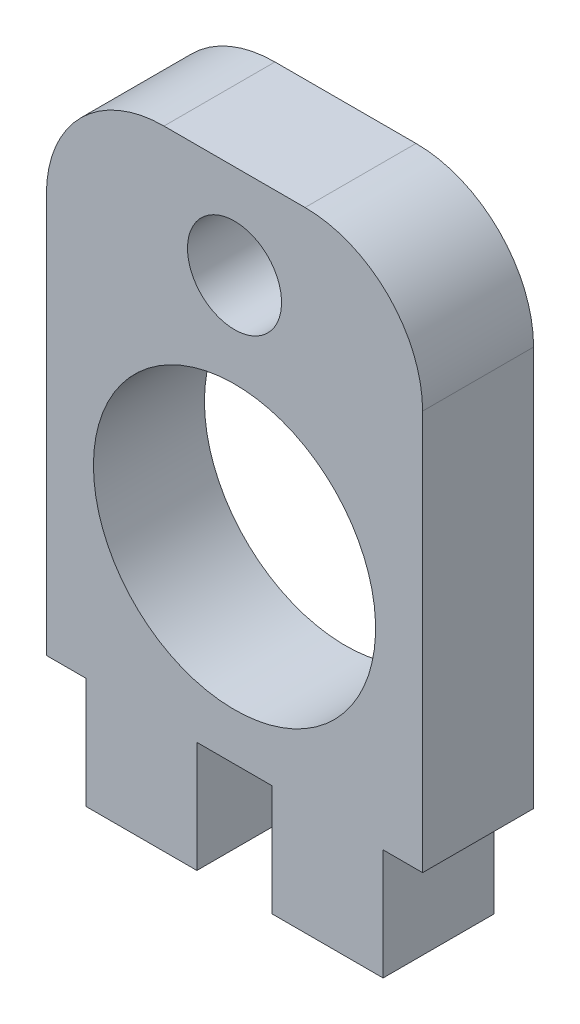
from build123d import *

# Parameters (mm, degrees)
SKETCH1_R           = 3.81
SKETCH1_R_2         = 1.27
BOSS_EXTRUDE1_DEPTH = 2.9972
FILLET1_R           = 3.175


with BuildPart() as part:
    # Sketch1 → Boss-Extrude1 (new body)
    with BuildSketch(Plane.XY):
        Polygon((0, 0), (1.0668, 0), (1.0668, -2.9972), (4.064, -2.9972), (4.064, 0), (6.096, 0), (6.096, -2.9972), (9.0932, -2.9972), (9.0932, 0), (10.16, 0), (10.16, 13.97), (0, 13.97), align=None)
        with Locations(Location((5.08, 5.08, 0), (0, 0, 180))):
            Circle(SKETCH1_R, mode=Mode.SUBTRACT)
        with Locations(Location((5.08, 11.43, 0), (0, 0, 180))):
            Circle(SKETCH1_R_2, mode=Mode.SUBTRACT)
    extrude(amount=BOSS_EXTRUDE1_DEPTH)

    # Fillet1
    fillet1_edges = [part.edges().sort_by_distance(p)[0] for p in [
        (0, 13.97, 1.4986),
        (10.16, 13.97, 1.4986),
    ]]
    fillet(fillet1_edges, radius=FILLET1_R)


solid = part.part
